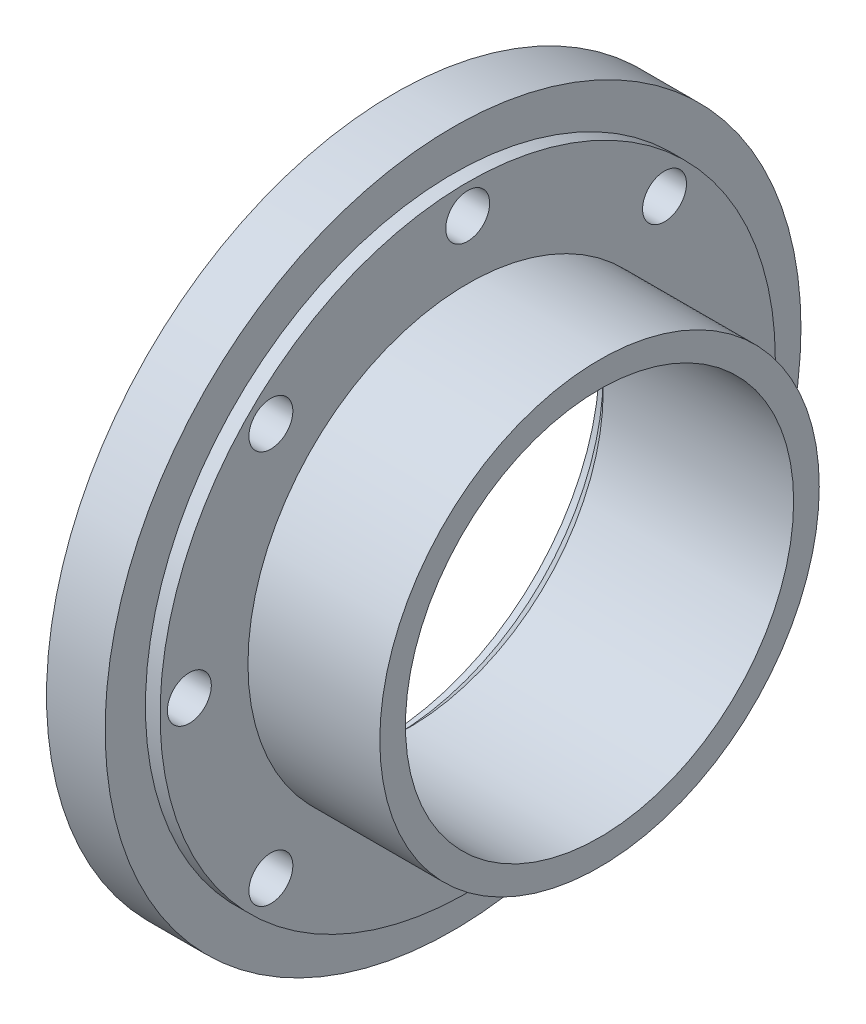
from build123d import *

# Parameters (mm, degrees)
CUT_EXTRUDE_1_REACH = 71.545
SKETCH_3_R          = 3
CHAMFER_1_SIZE      = 2


with BuildPart() as part:
    # 草图1 → 旋转1 (revolve)
    with BuildSketch(Plane.XY, mode=Mode.PRIVATE) as revolve_1_sk:
        Polygon((0, 0), (0, 34), (2, 34), (2, 47.5), (10, 47.5), (10, 42), (12, 42), (12, 30), (30, 30), (30, 0), align=None)
    revolve(revolve_1_sk.sketch.rotate(Axis((0, 0, 0), (-1, 0, 0)), 90), axis=Axis((0, 0, 0), (-1, 0, 0)))

    # 草图2 → 切除-旋转1 (revolve, cut)
    with BuildSketch(Plane.XY, mode=Mode.PRIVATE) as cut_revolve_1_sk:
        Polygon((0, 0), (0, 30), (2, 30), (2, 26.5), (30, 26.5), (30, 0), align=None)
    revolve(cut_revolve_1_sk.sketch.rotate(Axis((0, 0, 0), (-1, 0, 0)), 90), axis=Axis((0, 0, 0), (-1, 0, 0)), mode=Mode.SUBTRACT)

    # 草图3 → 切除-拉伸1 (cut, up to next)
    with BuildSketch(Plane(origin=(12, 0, 0), x_dir=(0, 0, -1), z_dir=(1, 0, 0)), mode=Mode.PRIVATE) as cut_extrude_1_sk1:
        with Locations((0, 38)):
            Circle(SKETCH_3_R)
    cut_extrude_1_tool1 = extrude(cut_extrude_1_sk1.sketch, amount=-CUT_EXTRUDE_1_REACH, mode=Mode.PRIVATE) & part.part
    # 草图3 → 切除-拉伸1 (cut, up to next)
    with BuildSketch(Plane(origin=(12, 0, 0), x_dir=(0, 0, -1), z_dir=(1, 0, 0)), mode=Mode.PRIVATE) as cut_extrude_1_sk2:
        with Locations((26.870057685, 26.870057685)):
            Circle(SKETCH_3_R)
    cut_extrude_1_tool2 = extrude(cut_extrude_1_sk2.sketch, amount=-CUT_EXTRUDE_1_REACH, mode=Mode.PRIVATE) & part.part
    # 草图3 → 切除-拉伸1 (cut, up to next)
    with BuildSketch(Plane(origin=(12, 0, 0), x_dir=(0, 0, -1), z_dir=(1, 0, 0)), mode=Mode.PRIVATE) as cut_extrude_1_sk3:
        with Locations((38, 0)):
            Circle(SKETCH_3_R)
    cut_extrude_1_tool3 = extrude(cut_extrude_1_sk3.sketch, amount=-CUT_EXTRUDE_1_REACH, mode=Mode.PRIVATE) & part.part
    # 草图3 → 切除-拉伸1 (cut, up to next)
    with BuildSketch(Plane(origin=(12, 0, 0), x_dir=(0, 0, -1), z_dir=(1, 0, 0)), mode=Mode.PRIVATE) as cut_extrude_1_sk4:
        with Locations((26.870057685, -26.870057685)):
            Circle(SKETCH_3_R)
    cut_extrude_1_tool4 = extrude(cut_extrude_1_sk4.sketch, amount=-CUT_EXTRUDE_1_REACH, mode=Mode.PRIVATE) & part.part
    # 草图3 → 切除-拉伸1 (cut, up to next)
    with BuildSketch(Plane(origin=(12, 0, 0), x_dir=(0, 0, -1), z_dir=(1, 0, 0)), mode=Mode.PRIVATE) as cut_extrude_1_sk5:
        with Locations((0, -38)):
            Circle(SKETCH_3_R)
    cut_extrude_1_tool5 = extrude(cut_extrude_1_sk5.sketch, amount=-CUT_EXTRUDE_1_REACH, mode=Mode.PRIVATE) & part.part
    # 草图3 → 切除-拉伸1 (cut, up to next)
    with BuildSketch(Plane(origin=(12, 0, 0), x_dir=(0, 0, -1), z_dir=(1, 0, 0)), mode=Mode.PRIVATE) as cut_extrude_1_sk6:
        with Locations((-26.870057685, -26.870057685)):
            Circle(SKETCH_3_R)
    cut_extrude_1_tool6 = extrude(cut_extrude_1_sk6.sketch, amount=-CUT_EXTRUDE_1_REACH, mode=Mode.PRIVATE) & part.part
    # 草图3 → 切除-拉伸1 (cut, up to next)
    with BuildSketch(Plane(origin=(12, 0, 0), x_dir=(0, 0, -1), z_dir=(1, 0, 0)), mode=Mode.PRIVATE) as cut_extrude_1_sk7:
        with Locations((-38, 0)):
            Circle(SKETCH_3_R)
    cut_extrude_1_tool7 = extrude(cut_extrude_1_sk7.sketch, amount=-CUT_EXTRUDE_1_REACH, mode=Mode.PRIVATE) & part.part
    # 草图3 → 切除-拉伸1 (cut, up to next)
    with BuildSketch(Plane(origin=(12, 0, 0), x_dir=(0, 0, -1), z_dir=(1, 0, 0)), mode=Mode.PRIVATE) as cut_extrude_1_sk8:
        with Locations((-26.870057685, 26.870057685)):
            Circle(SKETCH_3_R)
    cut_extrude_1_tool8 = extrude(cut_extrude_1_sk8.sketch, amount=-CUT_EXTRUDE_1_REACH, mode=Mode.PRIVATE) & part.part
    add(cut_extrude_1_tool1.solids().sort_by_distance((12, 38, 0))[0], mode=Mode.SUBTRACT)
    add(cut_extrude_1_tool2.solids().sort_by_distance((12, 26.870058, -26.870058))[0], mode=Mode.SUBTRACT)
    add(cut_extrude_1_tool3.solids().sort_by_distance((12, 0, -38))[0], mode=Mode.SUBTRACT)
    add(cut_extrude_1_tool4.solids().sort_by_distance((12, -26.870058, -26.870058))[0], mode=Mode.SUBTRACT)
    add(cut_extrude_1_tool5.solids().sort_by_distance((12, -38, 0))[0], mode=Mode.SUBTRACT)
    add(cut_extrude_1_tool6.solids().sort_by_distance((12, -26.870058, 26.870058))[0], mode=Mode.SUBTRACT)
    add(cut_extrude_1_tool7.solids().sort_by_distance((12, 0, 38))[0], mode=Mode.SUBTRACT)
    add(cut_extrude_1_tool8.solids().sort_by_distance((12, 26.870058, 26.870058))[0], mode=Mode.SUBTRACT)

    # 倒角1
    chamfer_1_edges = [part.edges().sort_by_distance(p)[0] for p in [
        (2, 0, 26.5),
    ]]
    chamfer(chamfer_1_edges, length=CHAMFER_1_SIZE)


solid = part.part
